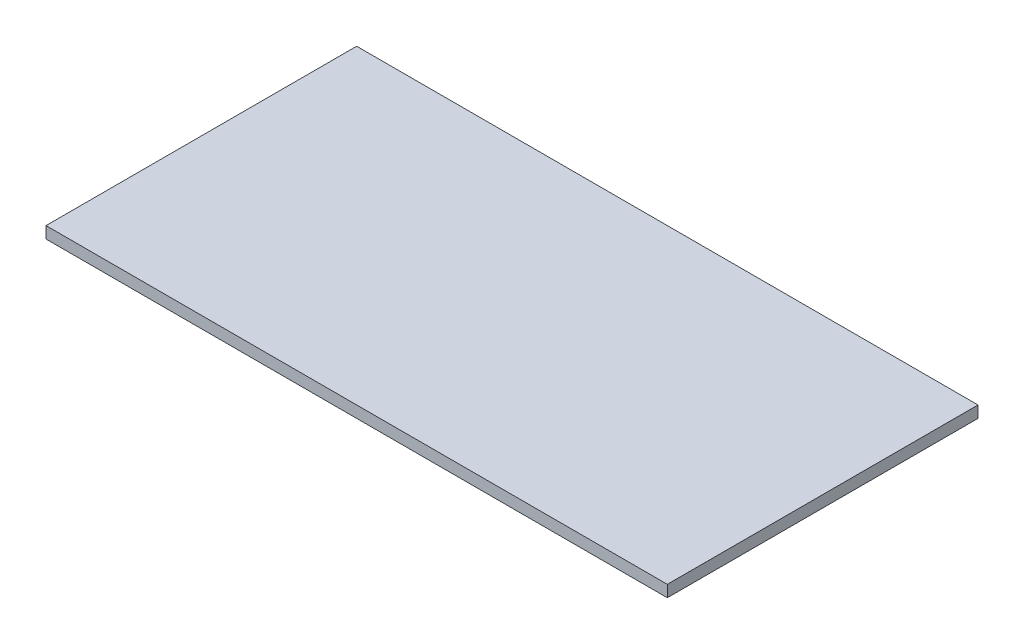
from build123d import *

# Parameters (mm, degrees)
SKETCH1_W           = 80
SKETCH1_H           = 40
BOSS_EXTRUDE1_DEPTH = 1.5


with BuildPart() as part:
    # Sketch1 → Boss-Extrude1 (new body)
    with BuildSketch(Plane(origin=(0, 0, 0), x_dir=(1, 0, 0), z_dir=(0, 1, 0))):
        with Locations((40, 20)):
            Rectangle(SKETCH1_W, SKETCH1_H)
    extrude(amount=BOSS_EXTRUDE1_DEPTH)


solid = part.part
